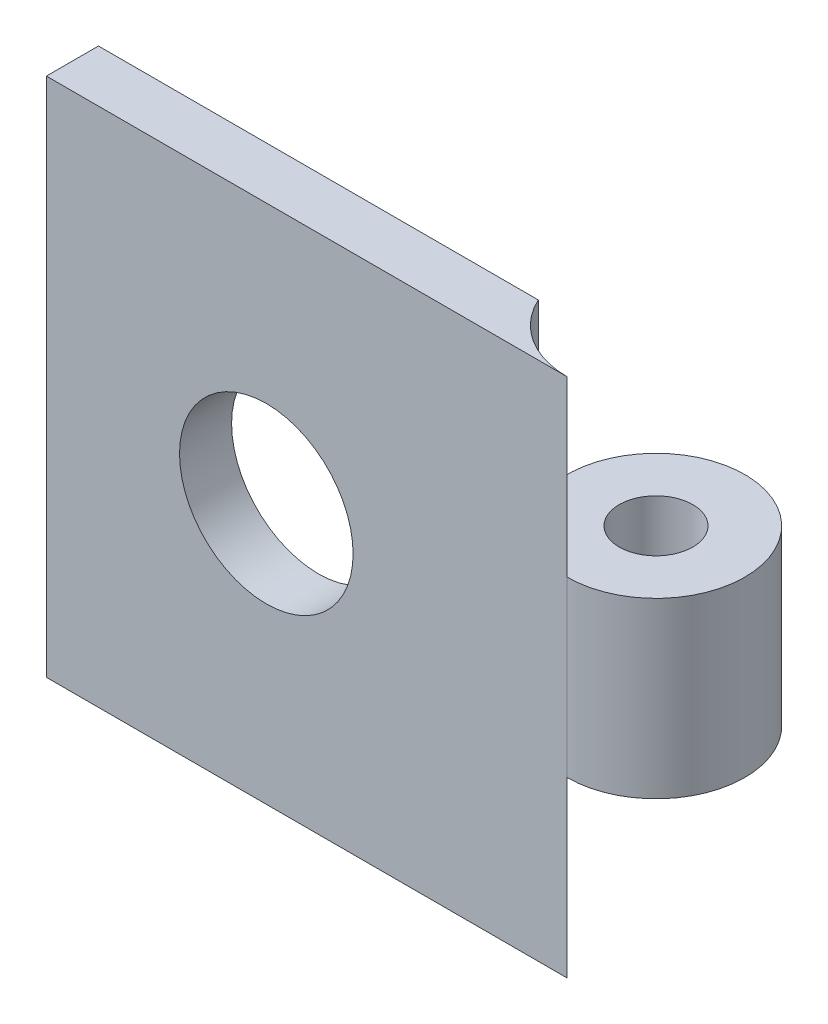
from build123d import *

# Parameters (mm, degrees)
BOSS_EXTRUDE1_DEPTH      = 7.5
BOSS_EXTRUDE1_DEPTH_BACK = 7.5
BOSS_EXTRUDE3_DEPTH      = 2.5
BOSS_EXTRUDE3_DEPTH_BACK = 2.5
SKETCH1_4_R              = 1.06
SKETCH2_R                = 2.5
CUT_EXTRUDE1_DEPTH       = 3


with BuildPart() as part:
    # Sketch1 → Boss-Extrude1 (new, two sides: drawn at the far end of the back side and taken through both)
    with BuildSketch(Plane(origin=(0, 0, 0), x_dir=(1, 0, 0), z_dir=(0, 1, 0)).offset(-BOSS_EXTRUDE1_DEPTH_BACK)):
        with BuildLine():
            Line((0, 1.5), (0, 0))
            Line((0, 0), (15, 0))
            ThreePointArc((15, 0), (13.614359354, 0.407420152), (12.66976396, 1.5))
            Line((12.66976396, 1.5), (0, 1.5))
        make_face()
    extrude(amount=BOSS_EXTRUDE1_DEPTH + BOSS_EXTRUDE1_DEPTH_BACK)

    # Sketch1<4> → Boss-Extrude3 (add, two sides: drawn at the far end of the back side and taken through both)
    with BuildSketch(Plane(origin=(0, 0, 0), x_dir=(1, 0, 0), z_dir=(0, 1, 0)).offset(-BOSS_EXTRUDE3_DEPTH_BACK)):
        with BuildLine():
            ThreePointArc((12.66976396, 1.5), (13.614359354, 0.407420152), (15, 0))
            ThreePointArc((15, 0), (16.81019336, 0.74980664), (17.56, 2.56))
            ThreePointArc((17.56, 2.56), (14.45769209, 5.061899704), (12.66976396, 1.5))
        make_face()
        with Locations((15, 2.56)):
            Circle(SKETCH1_4_R, mode=Mode.SUBTRACT)
    extrude(amount=BOSS_EXTRUDE3_DEPTH + BOSS_EXTRUDE3_DEPTH_BACK)

    # Sketch2 → Cut-Extrude1 (cut)
    with BuildSketch(Plane(origin=(0, 0, -1.5), x_dir=(-1, 0, 0), z_dir=(0, 0, -1))):
        with Locations((-6.33488198, 0)):
            Circle(SKETCH2_R)
    extrude(amount=-CUT_EXTRUDE1_DEPTH, mode=Mode.SUBTRACT)


solid = part.part
